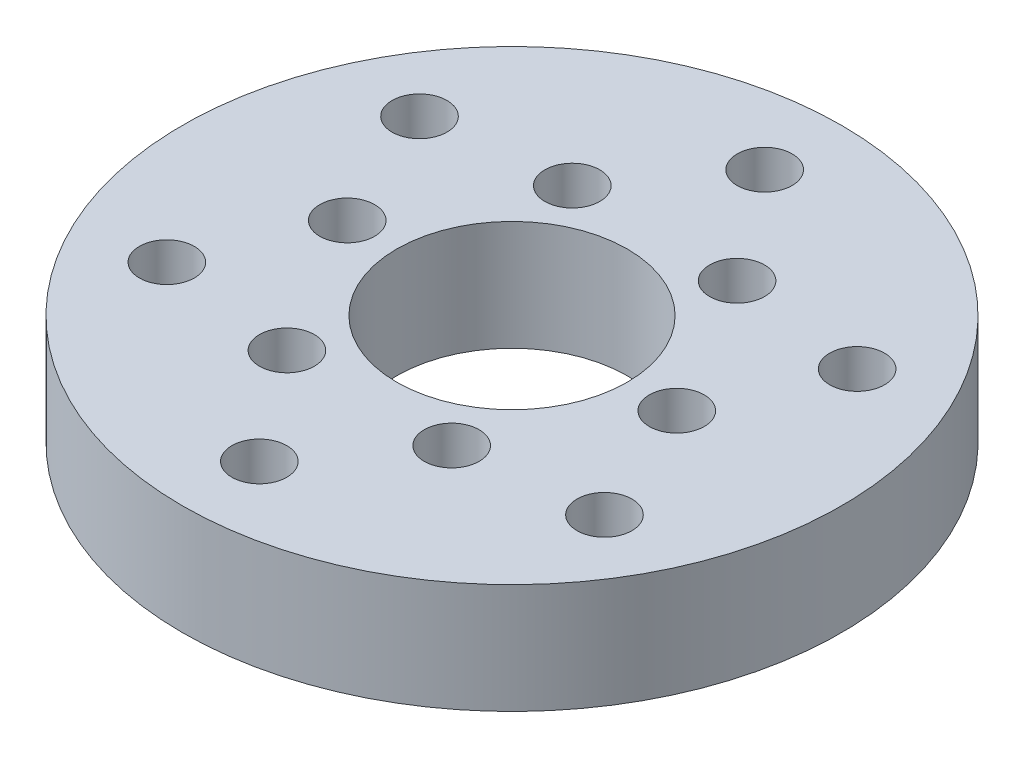
from build123d import *

# Parameters (mm, degrees)
SKETCH1_R           = 30
SKETCH1_R_2         = 2.5
SKETCH1_R_3         = 10.5
BOSS_EXTRUDE1_DEPTH = 10
SKETCH2_R           = 2.5
CUT_EXTRUDE1_DEPTH  = 10


with BuildPart() as part:
    # Sketch1 → Boss-Extrude1 (new body)
    with BuildSketch(Plane(origin=(0, 0, 0), x_dir=(1, 0, 0), z_dir=(0, 1, 0))):
        with Locations(Location((0, 0, 0), (0, 0, 270))):
            Circle(SKETCH1_R)
        with Locations(Location((0, 23, 0), (0, 0, 270))):
            Circle(SKETCH1_R_2, mode=Mode.SUBTRACT)
        with Locations(Location((19.918584287, 11.5, 0), (0, 0, 270))):
            Circle(SKETCH1_R_2, mode=Mode.SUBTRACT)
        with Locations(Location((19.918584287, -11.5, 0), (0, 0, 270))):
            Circle(SKETCH1_R_2, mode=Mode.SUBTRACT)
        with Locations(Location((0, -23, 0), (0, 0, 270))):
            Circle(SKETCH1_R_2, mode=Mode.SUBTRACT)
        with Locations(Location((-19.918584287, -11.5, 0), (0, 0, 270))):
            Circle(SKETCH1_R_2, mode=Mode.SUBTRACT)
        with Locations(Location((-19.918584287, 11.5, 0), (0, 0, 270))):
            Circle(SKETCH1_R_2, mode=Mode.SUBTRACT)
        with Locations(Location((0, 0, 0), (0, 0, 270))):
            Circle(SKETCH1_R_3, mode=Mode.SUBTRACT)
    extrude(amount=BOSS_EXTRUDE1_DEPTH)

    # Sketch2 → Cut-Extrude1 (cut)
    with BuildSketch(Plane(origin=(0, 10, 0), x_dir=(1, 0, 0), z_dir=(0, 1, 0))):
        with Locations(Location((-7.5, 12.990381057, 0), (0, 0, 270))):
            Circle(SKETCH2_R)
        with Locations(Location((7.5, 12.990381057, 0), (0, 0, 270))):
            Circle(SKETCH2_R)
        with Locations(Location((15, 0, 0), (0, 0, 270))):
            Circle(SKETCH2_R)
        with Locations(Location((7.5, -12.990381057, 0), (0, 0, 270))):
            Circle(SKETCH2_R)
        with Locations(Location((-7.5, -12.990381057, 0), (0, 0, 270))):
            Circle(SKETCH2_R)
        with Locations(Location((-15, 0, 0), (0, 0, 270))):
            Circle(SKETCH2_R)
    extrude(amount=-CUT_EXTRUDE1_DEPTH, mode=Mode.SUBTRACT)


solid = part.part
